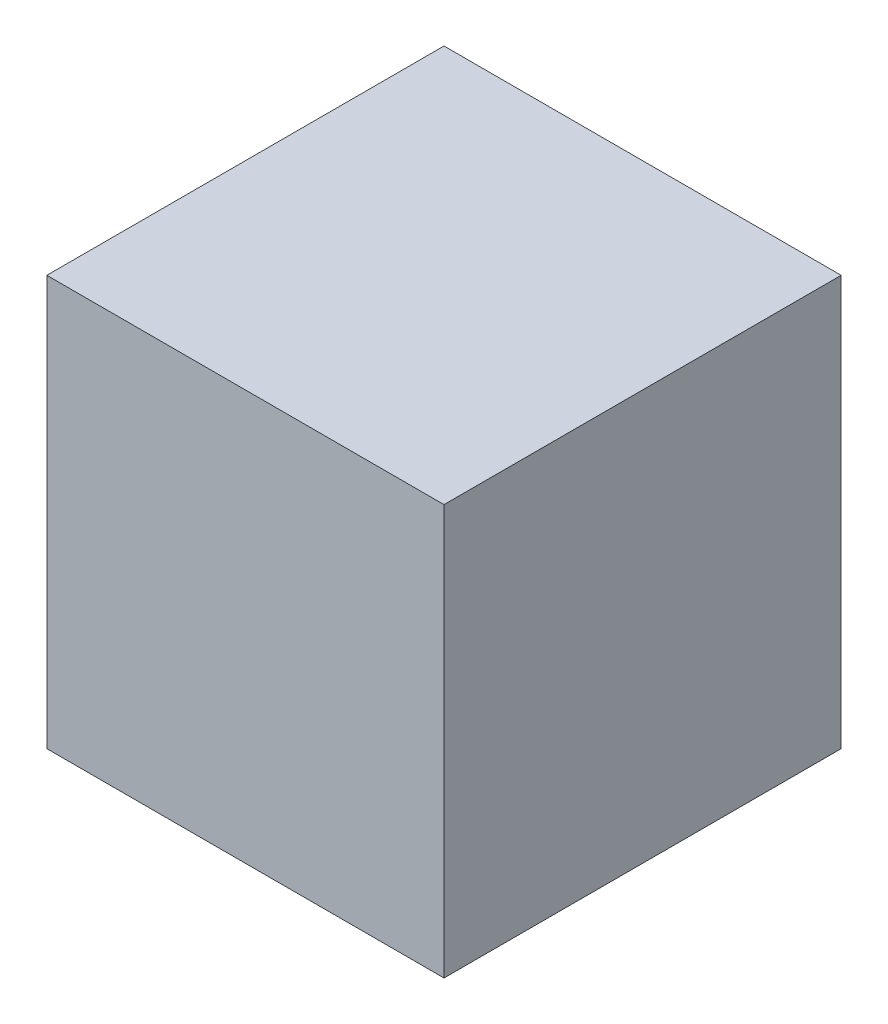
from build123d import *

# Parameters (mm, degrees)
SKETCH1_W           = 31
SKETCH1_H           = 31
BOSS_EXTRUDE1_DEPTH = 32


with BuildPart() as part:
    # Sketch1 → Boss-Extrude1 (new body)
    with BuildSketch(Plane(origin=(0, 0, 0), x_dir=(1, 0, 0), z_dir=(0, 1, 0))):
        Rectangle(SKETCH1_W, SKETCH1_H)
    extrude(amount=BOSS_EXTRUDE1_DEPTH)


solid = part.part
